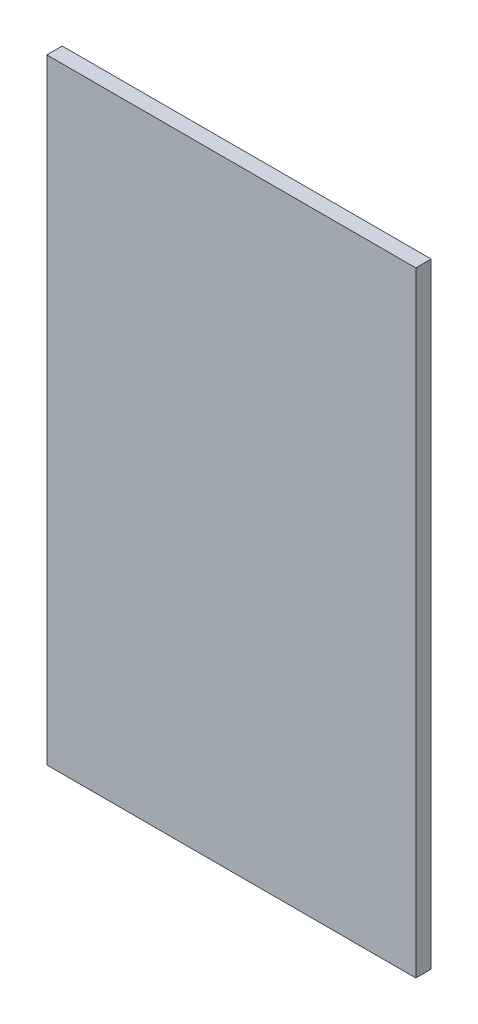
from build123d import *

# Parameters (mm, degrees)
SKETCH1_W           = 152.4
SKETCH1_H           = 254
BOSS_EXTRUDE1_DEPTH = 6.35


with BuildPart() as part:
    # Sketch1 → Boss-Extrude1 (new body)
    with BuildSketch(Plane.XY):
        with Locations((-172.853505065, -32.541428822)):
            Rectangle(SKETCH1_W, SKETCH1_H)
    extrude(amount=BOSS_EXTRUDE1_DEPTH)


solid = part.part
